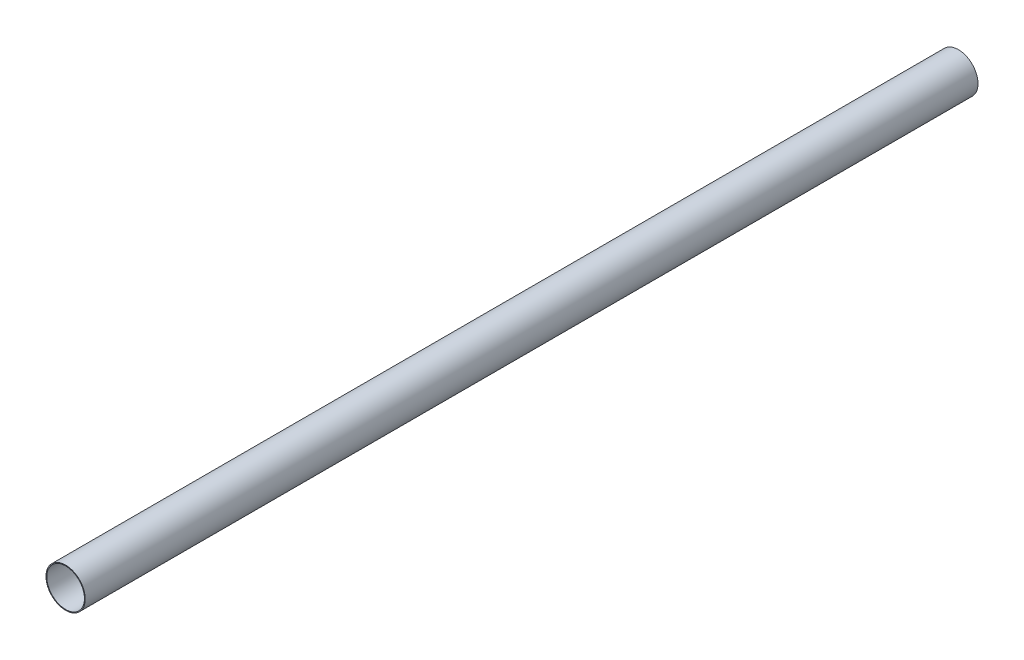
from build123d import *

# Parameters (mm, degrees)
SKETCH1_R           = 55
SKETCH1_R_2         = 52.8
BOSS_EXTRUDE1_DEPTH = 2500


with BuildPart() as part:
    # Sketch1 → Boss-Extrude1 (new body)
    with BuildSketch(Plane.XY):
        Circle(SKETCH1_R)
        Circle(SKETCH1_R_2, mode=Mode.SUBTRACT)
    extrude(amount=BOSS_EXTRUDE1_DEPTH)


solid = part.part
